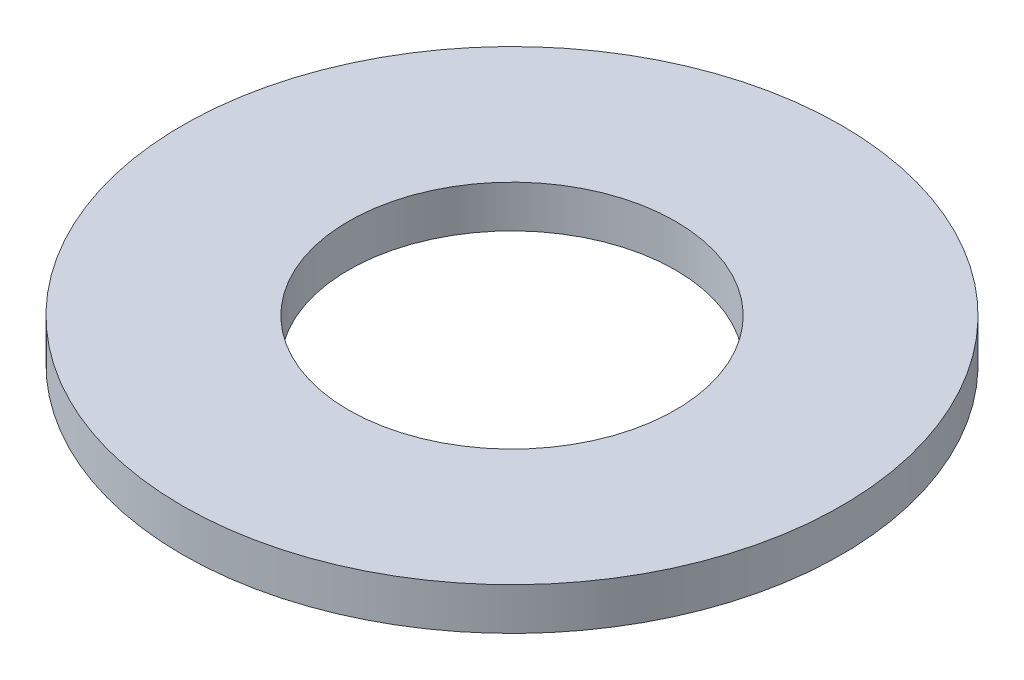
from build123d import *

# Parameters (mm, degrees)
SKETCH1_R           = 6.4
SKETCH1_R_2         = 3.175
BOSS_EXTRUDE1_DEPTH = 0.82


with BuildPart() as part:
    # Sketch1 → Boss-Extrude1 (new body)
    with BuildSketch(Plane(origin=(0, 0, 0), x_dir=(1, 0, 0), z_dir=(0, 1, 0))):
        with Locations(Location((0, 0, 0), (0, 0, 270))):
            Circle(SKETCH1_R)
        with Locations(Location((0, 0, 0), (0, 0, 270))):
            Circle(SKETCH1_R_2, mode=Mode.SUBTRACT)
    extrude(amount=BOSS_EXTRUDE1_DEPTH)


solid = part.part
